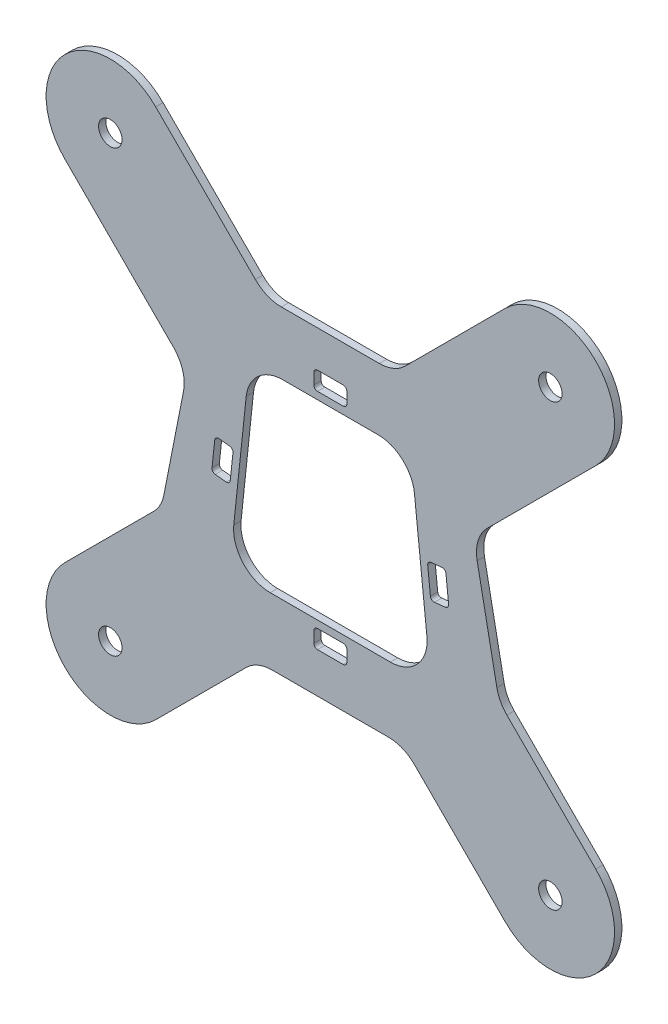
from build123d import *

# Parameters (mm, degrees)
AUFSATZ_LINEAR_AUSTRAGEN1_DEPTH      = 2
SKIZZE2_R                            = 3.2
SCHNITT_LINEAR_AUSTRAGEN1_DEPTH      = 2
SCHNITT_LINEAR_AUSTRAGEN3_DEPTH      = 2
VERRUNDUNG1_R                        = 10
VERRUNDUNG2_R                        = 10
SCHNITT_LINEAR_AUSTRAGEN4_DEPTH      = 112.222811939
SCHNITT_LINEAR_AUSTRAGEN4_DEPTH_BACK = 112.222811939


with BuildPart() as part:
    # Skizze1 → Aufsatz-Linear austragen1 (new body)
    with BuildSketch(Plane.XY):
        with BuildLine():
            Line((17.5, 44.5), (-17.5, 44.5))
            Line((-17.5, 44.5), (-47.625631329, 74.625631329))
            ThreePointArc((-47.625631329, 74.625631329), (-72.374368671, 74.625631329), (-72.374368671, 49.876893988))
            Line((-72.374368671, 49.876893988), (-39, 16.502525317))
            Line((-39, 16.502525317), (-46, -19))
            Line((-46, -19), (-72.374368671, -45.374368671))
            ThreePointArc((-72.374368671, -45.374368671), (-72.374368671, -70.123106012), (-47.625631329, -70.123106012))
            Line((-47.625631329, -70.123106012), (-20, -42.497474683))
            Line((-20, -42.497474683), (20, -42.497474683))
            Line((20, -42.497474683), (47.625631329, -70.123106012))
            ThreePointArc((47.625631329, -70.123106012), (72.374368671, -70.123106012), (72.374368671, -45.374368671))
            Line((72.374368671, -45.374368671), (46, -19))
            Line((46, -19), (39, 16.502525317))
            Line((39, 16.502525317), (72.374368671, 49.876893988))
            ThreePointArc((72.374368671, 49.876893988), (72.374368671, 74.625631329), (47.625631329, 74.625631329))
            Line((47.625631329, 74.625631329), (17.5, 44.5))
        make_face()
    extrude(amount=AUFSATZ_LINEAR_AUSTRAGEN1_DEPTH)

    # Skizze2 → Schnitt-Linear austragen1 (cut)
    with BuildSketch(Plane.XY.offset(2)):
        with Locations((-60, -57.748737342)):
            Circle(SKIZZE2_R)
        with Locations((-60, 62.251262658)):
            Circle(SKIZZE2_R)
        with Locations((60, -57.748737342)):
            Circle(SKIZZE2_R)
        with Locations((60, 62.251262658)):
            Circle(SKIZZE2_R)
    extrude(amount=-SCHNITT_LINEAR_AUSTRAGEN1_DEPTH, mode=Mode.SUBTRACT)

    # Skizze4 → Schnitt-Linear austragen3 (cut)
    with BuildSketch(Plane.XY.offset(2)):
        Polygon((-22, 27.5), (22, 27.5), (27.5, -24.5), (-27.5, -24.5), align=None)
    extrude(amount=-SCHNITT_LINEAR_AUSTRAGEN3_DEPTH, mode=Mode.SUBTRACT)

    # Verrundung1
    verrundung1_edges = [part.edges().sort_by_distance(p)[0] for p in [
        (-27.5, -24.5, 1),
        (-22, 27.5, 1),
        (22, 27.5, 1),
        (27.5, -24.5, 1),
    ]]
    fillet(verrundung1_edges, radius=VERRUNDUNG1_R)

    # Verrundung2
    verrundung2_edges = [part.edges().sort_by_distance(p)[0] for p in [
        (-17.5, 44.5, 1),
        (17.5, 44.5, 1),
        (39, 16.502525317, 1),
        (46, -19, 1),
        (20, -42.497474683, 1),
        (-20, -42.497474683, 1),
        (-46, -19, 1),
        (-39, 16.502525317, 1),
    ]]
    fillet(verrundung2_edges, radius=VERRUNDUNG2_R)

    # Skizze5 → Schnitt-Linear austragen4 (cut, two sides: drawn at the far end of the back side and taken through both)
    with BuildSketch(Plane.XY.offset(2).offset(-SCHNITT_LINEAR_AUSTRAGEN4_DEPTH_BACK)):
        with BuildLine():
            Line((-3.5, 34.5), (3.5, 34.5))
            ThreePointArc((3.5, 34.5), (4.207106781, 34.207106781), (4.5, 33.5))
            Line((4.5, 33.5), (4.5, 30.5))
            ThreePointArc((4.5, 30.5), (4.207106781, 29.792893219), (3.5, 29.5))
            Line((3.5, 29.5), (-3.5, 29.5))
            ThreePointArc((-3.5, 29.5), (-4.207106781, 29.792893219), (-4.5, 30.5))
            Line((-4.5, 30.5), (-4.5, 33.5))
            ThreePointArc((-4.5, 33.5), (-4.207106781, 34.207106781), (-3.5, 34.5))
        make_face()
        with BuildLine():
            Line((-30.424300248, 4.895768288), (-27.440941448, 4.580220723))
            ThreePointArc((-27.440941448, 4.580220723), (-26.768564282, 4.214576928), (-26.551671036, 3.480585268))
            Line((-26.551671036, 3.480585268), (-27.287948689, -3.480585268))
            ThreePointArc((-27.287948689, -3.480585268), (-27.653592484, -4.152962433), (-28.387584144, -4.369855679))
            Line((-28.387584144, -4.369855679), (-31.370942945, -4.054308114))
            ThreePointArc((-31.370942945, -4.054308114), (-32.04332011, -3.688664319), (-32.260213356, -2.954672658))
            Line((-32.260213356, -2.954672658), (-31.523935704, 4.006497877))
            ThreePointArc((-31.523935704, 4.006497877), (-31.158291909, 4.678875042), (-30.424300248, 4.895768288))
        make_face()
        with BuildLine():
            Line((26.551671036, 3.480585268), (27.287948689, -3.480585268))
            ThreePointArc((27.287948689, -3.480585268), (27.653592484, -4.152962433), (28.387584144, -4.369855679))
            Line((28.387584144, -4.369855679), (31.370942945, -4.054308114))
            ThreePointArc((31.370942945, -4.054308114), (32.04332011, -3.688664319), (32.260213356, -2.954672658))
            Line((32.260213356, -2.954672658), (31.523935704, 4.006497877))
            ThreePointArc((31.523935704, 4.006497877), (31.158291909, 4.678875042), (30.424300248, 4.895768288))
            Line((30.424300248, 4.895768288), (27.440941448, 4.580220723))
            ThreePointArc((27.440941448, 4.580220723), (26.768564282, 4.214576928), (26.551671036, 3.480585268))
        make_face()
        with BuildLine():
            Line((4.5, -30.5), (4.5, -27.5))
            ThreePointArc((4.5, -27.5), (4.207106781, -26.792893219), (3.5, -26.5))
            Line((3.5, -26.5), (-3.5, -26.5))
            ThreePointArc((-3.5, -26.5), (-4.207106781, -26.792893219), (-4.5, -27.5))
            Line((-4.5, -27.5), (-4.5, -30.5))
            ThreePointArc((-4.5, -30.5), (-4.207106781, -31.207106781), (-3.5, -31.5))
            Line((-3.5, -31.5), (3.5, -31.5))
            ThreePointArc((3.5, -31.5), (4.207106781, -31.207106781), (4.5, -30.5))
        make_face()
    extrude(amount=SCHNITT_LINEAR_AUSTRAGEN4_DEPTH + SCHNITT_LINEAR_AUSTRAGEN4_DEPTH_BACK, mode=Mode.SUBTRACT)


solid = part.part
